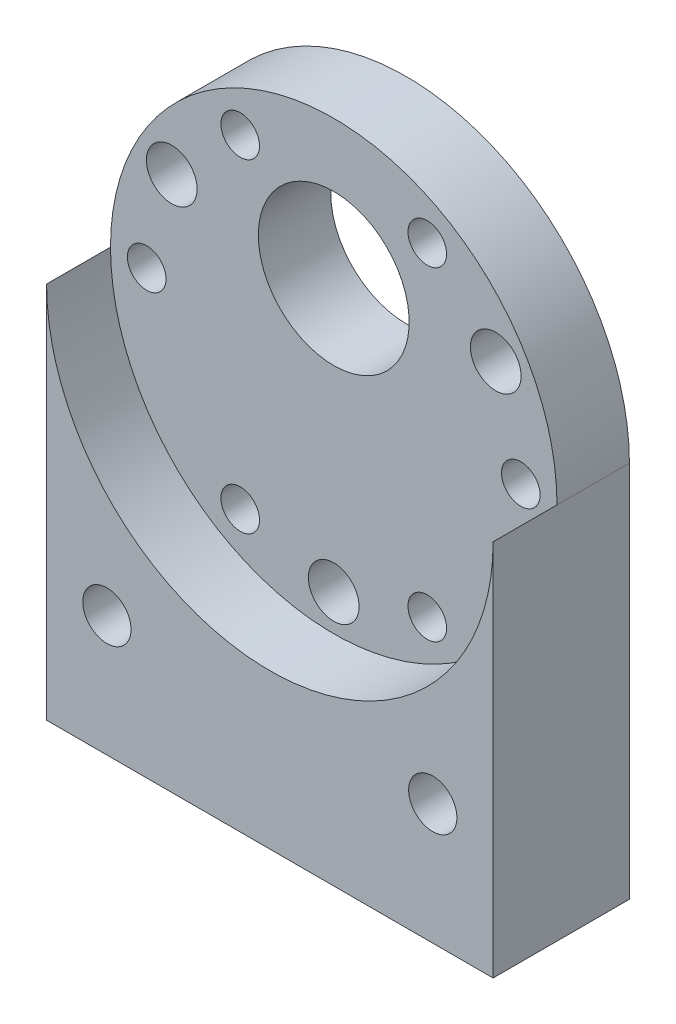
from build123d import *

# Parameters (mm, degrees)
SKETCH1_R           = 18.5
SKETCH1_R_2         = 6.25
SKETCH1_R_3         = 1.6
SKETCH1_R_4         = 2.1
BOSS_EXTRUDE1_DEPTH = 6
BOSS_EXTRUDE2_START = -6
SKETCH3_R           = 2
BOSS_EXTRUDE2_DEPTH = 11.295208
SKETCH4_R           = 3.5
CUT_EXTRUDE1_DEPTH  = 5


with BuildPart() as part:
    # Sketch1 → Boss-Extrude1 (new body)
    with BuildSketch(Plane.XY):
        with Locations(Location((0, 0, 0), (0, 0, 180))):
            Circle(SKETCH1_R)
        with Locations(Location((0, 7, 0), (0, 0, 180))):
            Circle(SKETCH1_R_2, mode=Mode.SUBTRACT)
        with Locations(Location((15.5, 0, 0), (0, 0, 180))):
            Circle(SKETCH1_R_3, mode=Mode.SUBTRACT)
        with Locations(Location((7.75, -13.423393759, 0), (0, 0, 180))):
            Circle(SKETCH1_R_3, mode=Mode.SUBTRACT)
        with Locations(Location((-7.75, -13.423393759, 0), (0, 0, 180))):
            Circle(SKETCH1_R_3, mode=Mode.SUBTRACT)
        with Locations(Location((-15.5, 0, 0), (0, 0, 180))):
            Circle(SKETCH1_R_3, mode=Mode.SUBTRACT)
        with Locations(Location((-7.75, 13.423393759, 0), (0, 0, 180))):
            Circle(SKETCH1_R_3, mode=Mode.SUBTRACT)
        with Locations(Location((7.75, 13.423393759, 0), (0, 0, 180))):
            Circle(SKETCH1_R_3, mode=Mode.SUBTRACT)
        with Locations(Location((13.423393759, 7.75, 0), (0, 0, 180))):
            Circle(SKETCH1_R_4, mode=Mode.SUBTRACT)
        with Locations(Location((0, -15.5, 0), (0, 0, 180))):
            Circle(SKETCH1_R_4, mode=Mode.SUBTRACT)
        with Locations(Location((-13.423393759, 7.75, 0), (0, 0, 180))):
            Circle(SKETCH1_R_4, mode=Mode.SUBTRACT)
    extrude(amount=BOSS_EXTRUDE1_DEPTH)

    # Sketch3 → Boss-Extrude2 (add)
    with BuildSketch(Plane.XY.offset(6).offset(BOSS_EXTRUDE2_START)):
        with BuildLine():
            ThreePointArc((18.5, 0), (0, -18.5), (-18.5, 0))
            Line((-18.5, 0), (-18.5, -31.300991))
            Line((-18.5, -31.300991), (18.5, -31.300991))
            Line((18.5, -31.300991), (18.5, 0))
        make_face()
        with Locations(Location((-13.5, -21.300991, 0), (0, 0, 180))):
            Circle(SKETCH3_R, mode=Mode.SUBTRACT)
        with Locations(Location((13.5, -21.300991, 0), (0, 0, 180))):
            Circle(SKETCH3_R, mode=Mode.SUBTRACT)
    extrude(amount=BOSS_EXTRUDE2_DEPTH)

    # Sketch4 → Cut-Extrude1 (cut)
    with BuildSketch(Plane(origin=(0, 0, 0), x_dir=(-1, 0, 0), z_dir=(0, 0, -1))):
        with Locations((-13.5, -21.300991)):
            Circle(SKETCH4_R)
        with Locations((13.5, -21.300991)):
            Circle(SKETCH4_R)
    extrude(amount=-CUT_EXTRUDE1_DEPTH, mode=Mode.SUBTRACT)


solid = part.part
